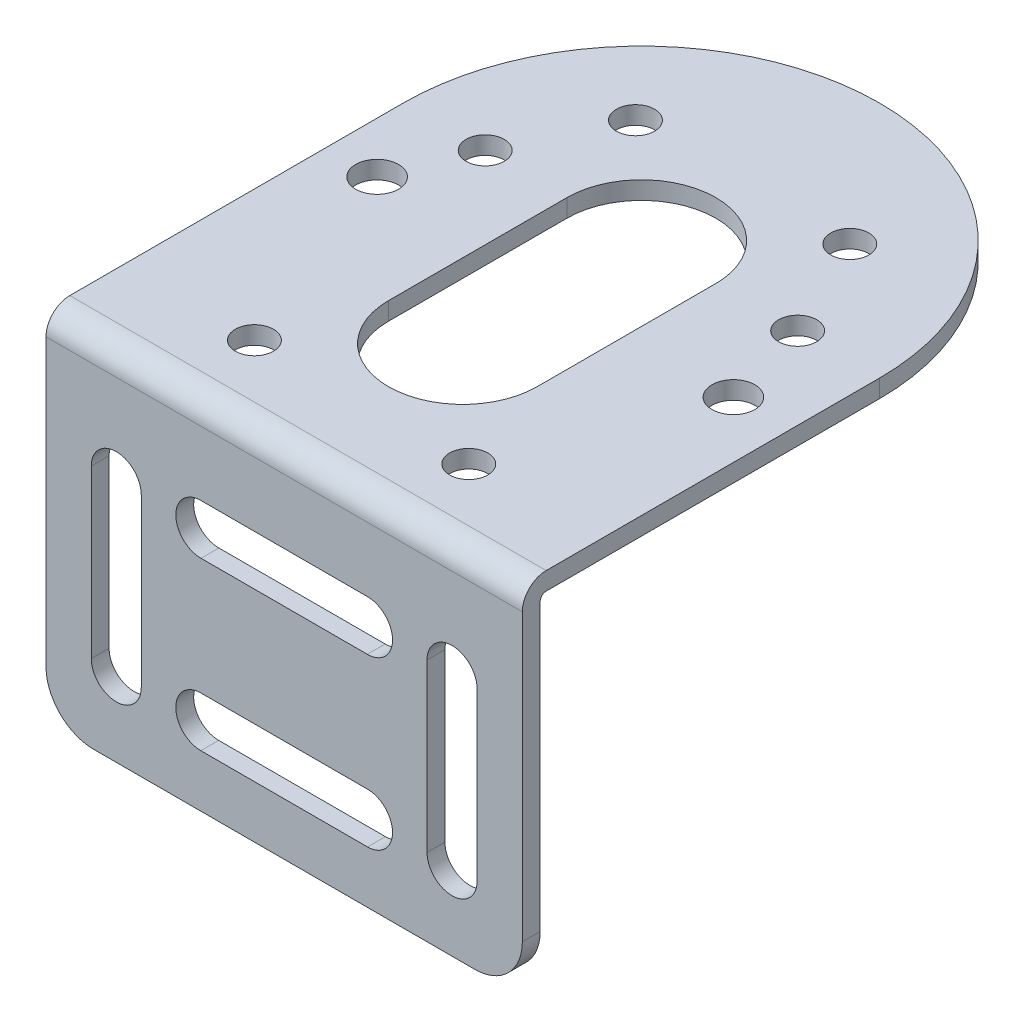
from build123d import *

# Parameters (mm, degrees)
BOSS_EXTRUDE1_DEPTH           = 30
SKETCH2_W                     = 28.5
SKETCH2_H                     = 28.5
CUT_EXTRUDE1_DEPTH            = 71.710678119
CUT_EXTRUDE2_REACH            = 63.644
CUT_EXTRUDE3_REACH            = 63.644
CUT_EXTRUDE4_REACH            = 63.644
CUT_EXTRUDE5_DEPTH            = 61.928236475
CUT_EXTRUDE6_DEPTH            = 61.433848132
SKETCH8_W                     = 1.601710745
SKETCH8_H                     = 1.5
M3_CLEARANCE_HOLE1_AT_2_COUNT = 2
M3_CLEARANCE_HOLE1_AT_2_PITCH = 18
M3_CLEARANCE_HOLE1_AT_3_COUNT = 2
M3_CLEARANCE_HOLE1_AT_3_PITCH = 32
M3_CLEARANCE_HOLE1_AT_4_COUNT = 2
M3_CLEARANCE_HOLE1_AT_4_PITCH = 36.715119501
M3_CLEARANCE_HOLE1_AT_5_COUNT = 2
M3_CLEARANCE_HOLE1_AT_5_PITCH = 23.858424089
M3_CLEARANCE_HOLE1_AT_6_COUNT = 2
M3_CLEARANCE_HOLE1_AT_6_PITCH = 32.272967016
FILLET1_R                     = 0.5
FILLET2_R                     = 2
FILLET3_R                     = 4
CUT_EXTRUDE7_DEPTH            = 28.5
SKETCH11_R                    = 1.801810181
CUT_EXTRUDE8_DEPTH            = 62.64414003


with BuildPart() as part:
    # Sketch1 → Boss-Extrude1 (new body)
    with BuildSketch(Plane.XZ.offset(30)):
        with BuildLine():
            Line((20, 0), (-20, 0))
            Line((-20, 0), (-20, -30))
            ThreePointArc((-20, -30), (0, -50), (20, -30))
            Line((20, -30), (20, 0))
        make_face()
    extrude(amount=-BOSS_EXTRUDE1_DEPTH)

    # Sketch2 → Cut-Extrude1 (cut, through all)
    with BuildSketch(Plane(origin=(20, 0, 0), x_dir=(0, 0, -1), z_dir=(1, 0, 0))):
        with Locations((15.75, -15.75)):
            Rectangle(SKETCH2_W, SKETCH2_H)
    extrude(amount=-CUT_EXTRUDE1_DEPTH, mode=Mode.SUBTRACT)

    # Sketch3 → Cut-Extrude2 (cut, up to next)
    with BuildSketch(Plane.XY, mode=Mode.PRIVATE) as cut_extrude2_sk1:
        with BuildLine():
            Line((16.2, -23.5), (16.2, -9.5))
            ThreePointArc((16.2, -9.5), (14.1, -7.4), (12, -9.5))
            Line((12, -9.5), (12, -23.5))
            ThreePointArc((12, -23.5), (14.1, -25.6), (16.2, -23.5))
        make_face()
    cut_extrude2_tool1 = extrude(cut_extrude2_sk1.sketch, amount=-CUT_EXTRUDE2_REACH, mode=Mode.PRIVATE) & part.part
    add(cut_extrude2_tool1.solids().sort_by_distance((14.1, -16.5, 0))[0], mode=Mode.SUBTRACT)

    # Sketch4 → Cut-Extrude3 (cut, up to next)
    with BuildSketch(Plane.XY, mode=Mode.PRIVATE) as cut_extrude3_sk1:
        with BuildLine():
            Line((-16.2, -9.5), (-16.2, -23.5))
            ThreePointArc((-16.2, -23.5), (-14.1, -25.6), (-12, -23.5))
            Line((-12, -23.5), (-12, -9.5))
            ThreePointArc((-12, -9.5), (-14.1, -7.4), (-16.2, -9.5))
        make_face()
    cut_extrude3_tool1 = extrude(cut_extrude3_sk1.sketch, amount=-CUT_EXTRUDE3_REACH, mode=Mode.PRIVATE) & part.part
    add(cut_extrude3_tool1.solids().sort_by_distance((-14.1, -16.5, 0))[0], mode=Mode.SUBTRACT)

    # Sketch5 → Cut-Extrude4 (cut, up to next)
    with BuildSketch(Plane.XY, mode=Mode.PRIVATE) as cut_extrude4_sk1:
        with BuildLine():
            Line((-6.981600402, -11.599919392), (6.981600402, -11.599919392))
            ThreePointArc((6.981600402, -11.599919392), (9.099979848, -9.509199887), (7, -7.4))
            Line((7, -7.4), (-7, -7.4))
            ThreePointArc((-7, -7.4), (-9.099979848, -9.509199887), (-6.981600402, -11.599919392))
        make_face()
    cut_extrude4_tool1 = extrude(cut_extrude4_sk1.sketch, amount=-CUT_EXTRUDE4_REACH, mode=Mode.PRIVATE) & part.part
    add(cut_extrude4_tool1.solids().sort_by_distance((0, -9.499967, 0))[0], mode=Mode.SUBTRACT)

    # Sketch6 → Cut-Extrude5 (cut, through all)
    with BuildSketch(Plane.XZ.offset(1.5)):
        with BuildLine():
            Line((6.25, -30), (6.25, -15))
            ThreePointArc((6.25, -15), (0, -8.75), (-6.25, -15))
            Line((-6.25, -15), (-6.25, -30))
            ThreePointArc((-6.25, -30), (0, -36.25), (6.25, -30))
        make_face()
    extrude(amount=-CUT_EXTRUDE5_DEPTH, mode=Mode.SUBTRACT)

    # Sketch7 → Cut-Extrude6 (cut, through all)
    with BuildSketch(Plane(origin=(0, 0, -1.5), x_dir=(-1, 0, 0), z_dir=(0, 0, -1))):
        with BuildLine():
            Line((-7, -25.6), (7, -25.6))
            ThreePointArc((7, -25.6), (9.1, -23.5), (7, -21.4))
            Line((7, -21.4), (-7, -21.4))
            ThreePointArc((-7, -21.4), (-9.1, -23.5), (-7, -25.6))
        make_face()
    extrude(amount=-CUT_EXTRUDE6_DEPTH, mode=Mode.SUBTRACT)

    # Sketch8 → M3 Clearance Hole1 (revolve, cut)
    with BuildSketch(Plane(origin=(-9, -1.5, -6.5), x_dir=(0, 0, -1), z_dir=(1, 0, 0))):
        with Locations((0.800855373, 0.75)):
            Rectangle(SKETCH8_W, SKETCH8_H)
    m3_clearance_hole1 = revolve(axis=Axis((-9, -7.85, -6.5), (0, 1, 0)), mode=Mode.SUBTRACT)

    # M3 Clearance Hole1 at 2: M3 Clearance Hole1 ×2
    with Locations(*[(i * M3_CLEARANCE_HOLE1_AT_2_PITCH, 0, 0) for i in range(1, M3_CLEARANCE_HOLE1_AT_2_COUNT)]):
        add(m3_clearance_hole1, mode=Mode.SUBTRACT)

    # M3 Clearance Hole1 at 3: M3 Clearance Hole1 ×2
    with Locations(*[(0, 0, -i * M3_CLEARANCE_HOLE1_AT_3_PITCH) for i in range(1, M3_CLEARANCE_HOLE1_AT_3_COUNT)]):
        add(m3_clearance_hole1, mode=Mode.SUBTRACT)

    # M3 Clearance Hole1 at 4: M3 Clearance Hole1 ×2
    with Locations(*[Vector(0.4902612396325592, 0, -0.8715755371245493) * (i * M3_CLEARANCE_HOLE1_AT_4_PITCH) for i in range(1, M3_CLEARANCE_HOLE1_AT_4_COUNT)]):
        add(m3_clearance_hole1, mode=Mode.SUBTRACT)

    # M3 Clearance Hole1 at 5: M3 Clearance Hole1 ×2
    with Locations(*[Vector(-0.17268533682984544, 0, -0.9849770425974216) * (i * M3_CLEARANCE_HOLE1_AT_5_PITCH) for i in range(1, M3_CLEARANCE_HOLE1_AT_5_COUNT)]):
        add(m3_clearance_hole1, mode=Mode.SUBTRACT)

    # M3 Clearance Hole1 at 6: M3 Clearance Hole1 ×2
    with Locations(*[Vector(0.6854033590776325, 0, -0.7281636048067069) * (i * M3_CLEARANCE_HOLE1_AT_6_PITCH) for i in range(1, M3_CLEARANCE_HOLE1_AT_6_COUNT)]):
        add(m3_clearance_hole1, mode=Mode.SUBTRACT)

    # Fillet1
    fillet1_edges = [part.edges().sort_by_distance(p)[0] for p in [
        (0, -1.5, -1.5),
    ]]
    fillet(fillet1_edges, radius=FILLET1_R)

    # Fillet2
    fillet2_edges = [part.edges().sort_by_distance(p)[0] for p in [
        (0, 0, 0),
    ]]
    fillet(fillet2_edges, radius=FILLET2_R)

    # Fillet3
    fillet3_edges = [part.edges().sort_by_distance(p)[0] for p in [
        (20, -30, -0.75),
        (-20, -30, -0.75),
    ]]
    fillet(fillet3_edges, radius=FILLET3_R)

    # Sketch10 → Cut-Extrude7 (cut)
    with BuildSketch(Plane.XZ.offset(30)):
        with BuildLine():
            Line((-20, -30), (20, -30))
            ThreePointArc((20, -30), (0, -50), (-20, -30))
        make_face()
    extrude(amount=-CUT_EXTRUDE7_DEPTH, mode=Mode.SUBTRACT)

    # Sketch11 → Cut-Extrude8 (cut, through all)
    with BuildSketch(Plane(origin=(0, 0, 0), x_dir=(1, 0, 0), z_dir=(0, 1, 0))):
        with Locations(Location((-15.73061053, 23.534870495, 0), (0, 0, 270))):
            Circle(SKETCH11_R)
        with Locations(Location((15.251209648, 22.473339956, 0), (0, 0, 270))):
            Circle(SKETCH11_R)
    extrude(amount=-CUT_EXTRUDE8_DEPTH, mode=Mode.SUBTRACT)


solid = part.part
